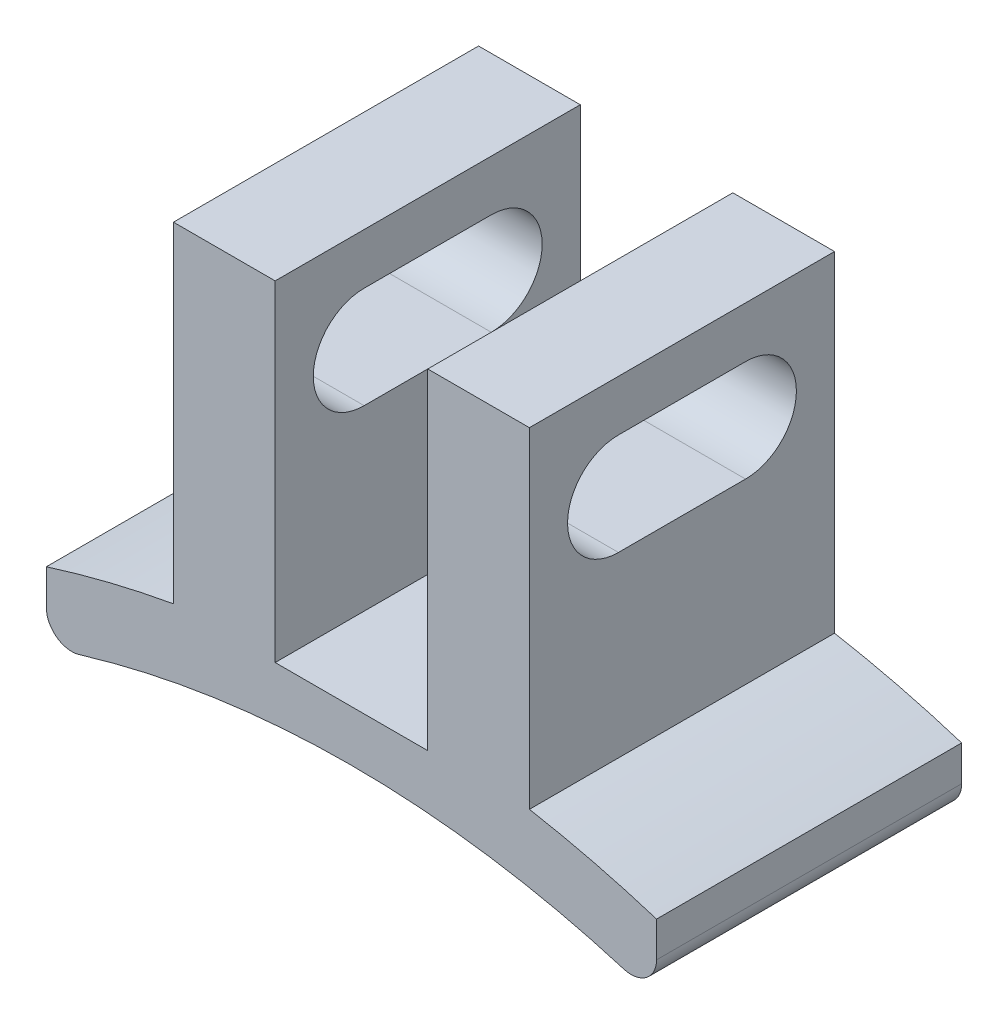
from build123d import *

# Parameters (mm, degrees)
BOSS_EXTRUDE1_DEPTH     = 3
CUT_EXTRUDE4_DEPTH      = 13.469963913
CUT_EXTRUDE4_DEPTH_BACK = 13.469963913
CUT_EXTRUDE5_DEPTH      = 12.324751653
CUT_EXTRUDE5_DEPTH_BACK = 12.324751653
SKETCH6_R               = 18.5
FILLET1_R               = 0.5


with BuildPart() as part:
    # Sketch1 → Boss-Extrude1 (new, symmetric)
    with BuildSketch(Plane.XY):
        Polygon((-6, -1), (6, -1), (6, 1), (3.5, 1), (3.5, 7.5), (1.5, 7.5), (1.5, 1), (-1.5, 1), (-1.5, 7.5), (-3.5, 7.5), (-3.5, 1), (-6, 1), align=None)
    extrude(amount=BOSS_EXTRUDE1_DEPTH, both=True)

    # Sketch5 → Cut-Extrude4 (cut, two sides: drawn at the far end of the back side and taken through both)
    with BuildSketch(Plane.ZY.offset(3.5).offset(-CUT_EXTRUDE4_DEPTH_BACK)):
        with BuildLine():
            Line((1.25, 4.5), (-1.25, 4.5))
            ThreePointArc((-1.25, 4.5), (-2.25, 5.5), (-1.25, 6.5))
            Line((-1.25, 6.5), (1.25, 6.5))
            ThreePointArc((1.25, 6.5), (2.25, 5.5), (1.25, 4.5))
        make_face()
    extrude(amount=CUT_EXTRUDE4_DEPTH + CUT_EXTRUDE4_DEPTH_BACK, mode=Mode.SUBTRACT)

    # Sketch6 → Cut-Extrude5 (cut, two sides: drawn at the far end of the back side and taken through both)
    with BuildSketch(Plane.XY.offset(3).offset(-CUT_EXTRUDE5_DEPTH_BACK)):
        with Locations((0, -18.5)):
            Circle(SKETCH6_R)
        with BuildLine():
            Line((-6, 1), (-3.5, 1))
            ThreePointArc((-3.5, 1), (-4.760065757, 0.731270733), (-6, 0.381207588))
            Line((-6, 0.381207588), (-6, 1))
        make_face()
        with BuildLine():
            Line((3.5, 1), (6, 1))
            Line((6, 1), (6, 0.381207588))
            ThreePointArc((6, 0.381207588), (4.760065757, 0.731270733), (3.5, 1))
        make_face()
    extrude(amount=CUT_EXTRUDE5_DEPTH + CUT_EXTRUDE5_DEPTH_BACK, mode=Mode.SUBTRACT)

    # Fillet1
    fillet1_edges = [part.edges().sort_by_distance(p)[0] for p in [
        (6, -1, 0),
        (-6, -1, 0),
    ]]
    fillet(fillet1_edges, radius=FILLET1_R)


solid = part.part
